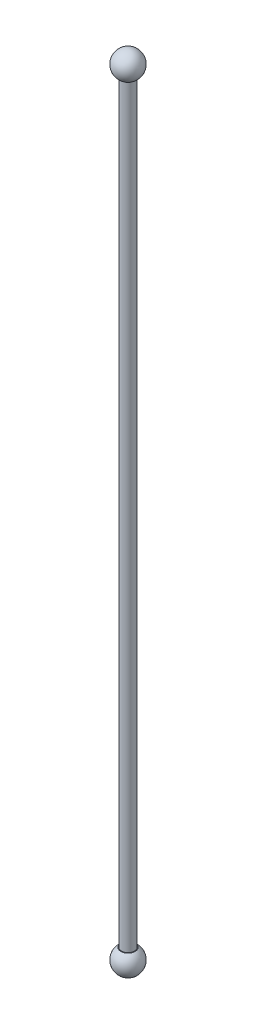
from build123d import *

# Parameters (mm, degrees)
SKETCH_1_W = 1
SKETCH_1_H = 350.7


with BuildPart() as part:
    # Эскиз1 → Повернуть1 (revolve)
    with BuildSketch(Plane.XY, mode=Mode.PRIVATE) as revolve_1_sk:
        with Locations((2.5, 0)):
            Rectangle(SKETCH_1_W, SKETCH_1_H)
    revolve(revolve_1_sk.sketch.rotate(Axis((0, 0, 0), (0, 1, 0)), 90), axis=Axis((0, 0, 0), (0, 1, 0)))

    # Эскиз2 → Повернуть5 (revolve)
    with BuildSketch(Plane.XY):
        with BuildLine():
            Line((0, 175.35), (0, 186.35))
            ThreePointArc((0, 186.35), (5.744562647, 182.082050808), (3.31662479, 175.35))
            Line((3.31662479, 175.35), (0, 175.35))
        make_face()
    revolve_5 = revolve(axis=Axis((0, 175.35, 0), (0, 1, 0)))

    # Зеркальное отражение1: Повернуть5 across plane
    add(revolve_5.mirror(Plane.ZX))


solid = part.part
